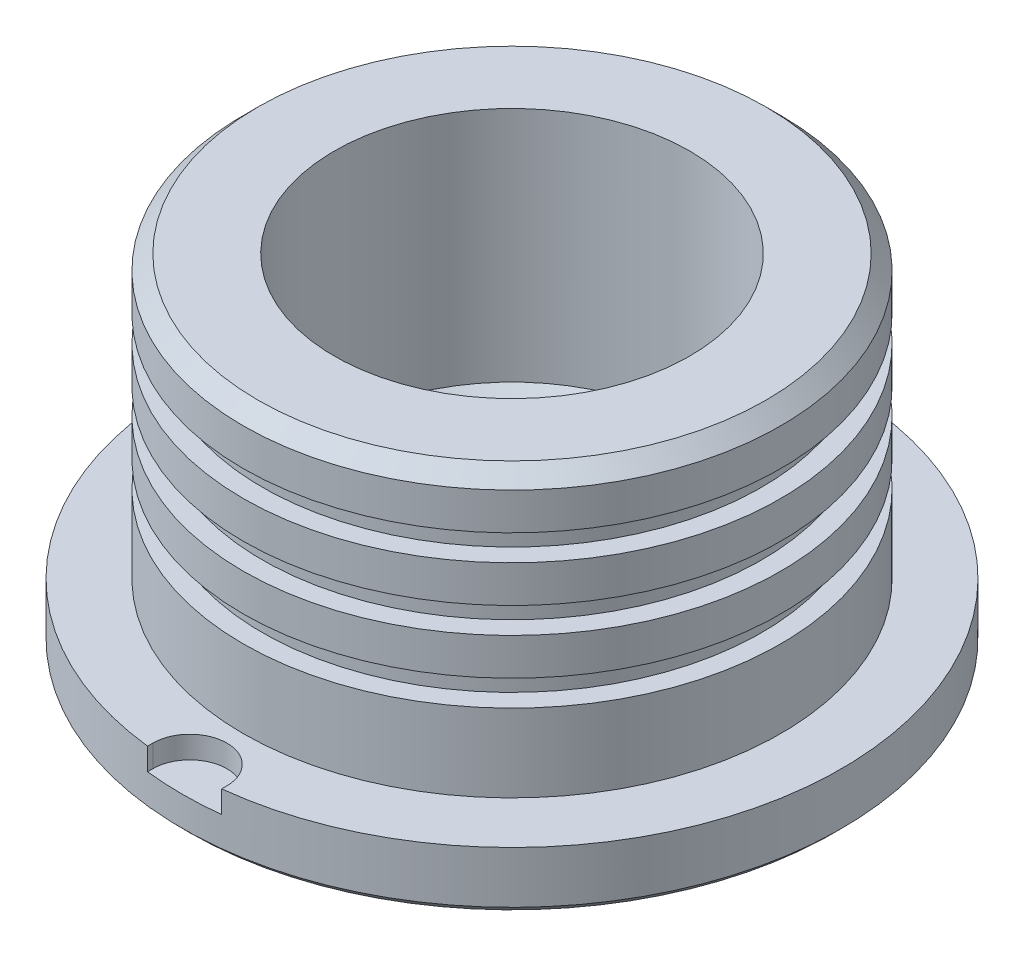
from build123d import *

# Parameters (mm, degrees)
CORTE_EXTRUS_O1_DEPTH = 3
ESBO_O4_R             = 5
CORTE_EXTRUS_O2_DEPTH = 72.529714105
CHANFRO1_SIZE         = 2
CHANFRO2_SIZE         = 2
CHANFRO3_SIZE         = 1


with BuildPart() as part:
    # Esboço1 → Revolução1 (revolve)
    with BuildSketch(Plane.XY, mode=Mode.PRIVATE) as revolu_o1_sk:
        Polygon((44.5, 0), (44.5, 8), (36.3, 8), (36.3, 18.5), (33.7, 18.5), (33.7, 22), (36.3, 22), (36.3, 27), (33.7, 27), (33.7, 30.5), (36.3, 30.5), (36.3, 35.5), (33.7, 35.5), (33.7, 39), (36.3, 39), (36.3, 46), (24, 46), (24, 12), (0, 12), (0, 0), align=None)
    revolve(revolu_o1_sk.sketch.rotate(Axis((0, 0, 0), (0, 1, 0)), 90), axis=Axis((0, 0, 0), (0, 1, 0)))

    # Esboço2 → Corte-extrusão1 (cut)
    with BuildSketch(Plane(origin=(0, 8, 0), x_dir=(1, 0, 0), z_dir=(0, 1, 0))):
        with BuildLine():
            Line((-5, 43.5), (-5, 45.5))
            ThreePointArc((-5, 45.5), (0, 50.5), (5, 45.5))
            Line((5, 45.5), (5, 43.5))
            ThreePointArc((5, 43.5), (0, 38.5), (-5, 43.5))
        make_face()
        with BuildLine():
            Line((-5, -43.5), (-5, -45.5))
            ThreePointArc((-5, -45.5), (0, -50.5), (5, -45.5))
            Line((5, -45.5), (5, -43.5))
            ThreePointArc((5, -43.5), (0, -38.5), (-5, -43.5))
        make_face()
    extrude(amount=-CORTE_EXTRUS_O1_DEPTH, mode=Mode.SUBTRACT)

    # Esboço4 → Corte-extrusão2 (cut, through all)
    with BuildSketch(Plane(origin=(0, 12, 0), x_dir=(1, 0, 0), z_dir=(0, 1, 0))):
        with Locations(Location((-9.941125497, 9.941125497, 0), (0, 0, 270))):
            Circle(ESBO_O4_R)
        with Locations(Location((9.941125497, 9.941125497, 0), (0, 0, 270))):
            Circle(ESBO_O4_R)
        with Locations(Location((-9.941125497, -9.941125497, 0), (0, 0, 270))):
            Circle(ESBO_O4_R)
        with Locations(Location((9.941125497, -9.941125497, 0), (0, 0, 270))):
            Circle(ESBO_O4_R)
    extrude(amount=-CORTE_EXTRUS_O2_DEPTH, mode=Mode.SUBTRACT)

    # Chanfro1
    chanfro1_edges = [part.edges().sort_by_distance(p)[0] for p in [
        (0, 46, 36.3),
    ]]
    chamfer(chanfro1_edges, length=CHANFRO1_SIZE)

    # Chanfro2
    chanfro2_edges = [part.edges().sort_by_distance(p)[0] for p in [
        (0, 12, 24),
    ]]
    chamfer(chanfro2_edges, length=CHANFRO2_SIZE)

    # Chanfro3
    chanfro3_edges = [part.edges().sort_by_distance(p)[0] for p in [
        (0, 0, 44.5),
    ]]
    chamfer(chanfro3_edges, length=CHANFRO3_SIZE)


solid = part.part
